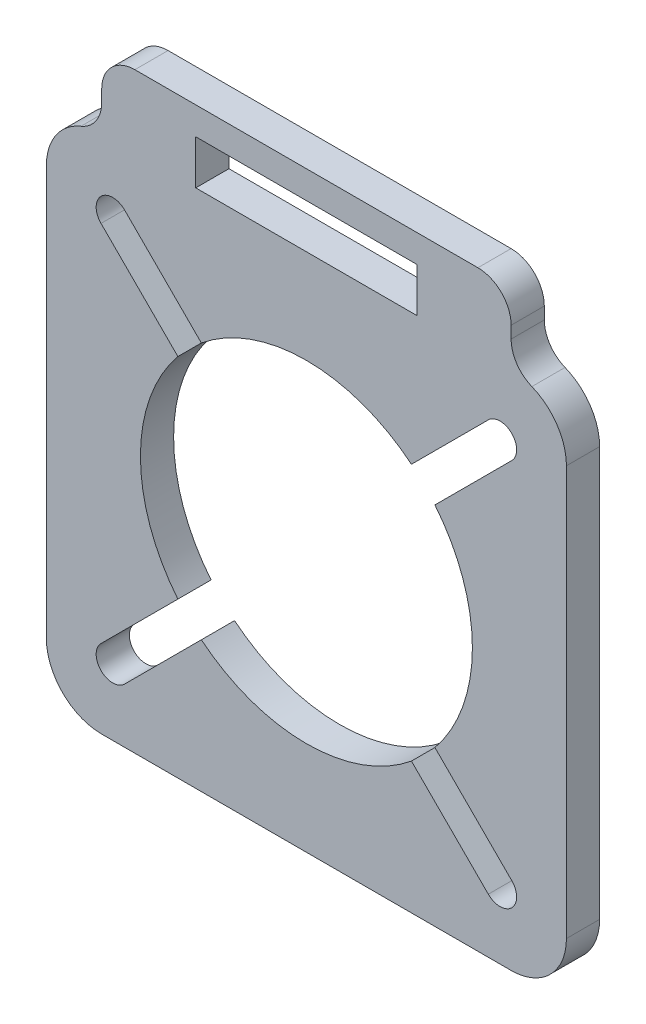
from build123d import *

# Parameters (mm, degrees)
EXTRUDE_1_DEPTH     = 3
SKETCH_2_W          = 37
SKETCH_2_H          = 3
EXTRUDE_2_DEPTH     = 6.5
SKETCH_3_W          = 20
SKETCH_3_H          = 4
CUT_EXTRUDE_1_DEPTH = 5
FILLET_2_R          = 3
EXTRUDE_START       = -3
EXTRUDE_4_DEPTH     = 3


with BuildPart() as part:
    # 草图1 → 凸台-拉伸1 (new body)
    with BuildSketch(Plane.XY):
        with BuildLine():
            Line((18.5, 23.5), (-18.5, 23.5))
            ThreePointArc((-18.5, 23.5), (-22.035533906, 22.035533906), (-23.5, 18.5))
            Line((-23.5, 18.5), (-23.5, -18.5))
            ThreePointArc((-23.5, -18.5), (-22.035533906, -22.035533906), (-18.5, -23.5))
            Line((-18.5, -23.5), (18.5, -23.5))
            ThreePointArc((18.5, -23.5), (22.035533906, -22.035533906), (23.5, -18.5))
            Line((23.5, -18.5), (23.5, 18.5))
            ThreePointArc((23.5, 18.5), (22.035533906, 22.035533906), (18.5, 23.5))
        make_face()
        with BuildLine():
            Line((-12.196084122, 8.732441359), (-19.231821381, 15.768178619))
            ThreePointArc((-19.231821381, 15.768178619), (-19.231821381, 19.231821381), (-15.768178619, 19.231821381))
            Line((-15.768178619, 19.231821381), (-8.732441359, 12.196084122))
            ThreePointArc((-8.732441359, 12.196084122), (0, 15), (8.732441359, 12.196084122))
            Line((8.732441359, 12.196084122), (15.768178619, 19.231821381))
            ThreePointArc((15.768178619, 19.231821381), (19.231821381, 19.231821381), (19.231821381, 15.768178619))
            Line((19.231821381, 15.768178619), (12.196084122, 8.732441359))
            ThreePointArc((12.196084122, 8.732441359), (15, 0), (12.196084122, -8.732441359))
            Line((12.196084122, -8.732441359), (19.231821381, -15.768178619))
            ThreePointArc((19.231821381, -15.768178619), (19.231821381, -19.231821381), (15.768178619, -19.231821381))
            Line((15.768178619, -19.231821381), (8.732441359, -12.196084122))
            ThreePointArc((8.732441359, -12.196084122), (0, -15), (-8.732441359, -12.196084122))
            Line((-8.732441359, -12.196084122), (-15.768178619, -19.231821381))
            ThreePointArc((-15.768178619, -19.231821381), (-19.231821381, -19.231821381), (-19.231821381, -15.768178619))
            Line((-19.231821381, -15.768178619), (-12.196084122, -8.732441359))
            ThreePointArc((-12.196084122, -8.732441359), (-15, 0), (-12.196084122, 8.732441359))
        make_face(mode=Mode.SUBTRACT)
    extrude(amount=EXTRUDE_1_DEPTH)

    # 草图2 → 凸台-拉伸2 (add)
    with BuildSketch(Plane(origin=(0, 23.5, 0), x_dir=(1, 0, 0), z_dir=(0, 1, 0))):
        with Locations((0, -1.5)):
            Rectangle(SKETCH_2_W, SKETCH_2_H)
    extrude(amount=EXTRUDE_2_DEPTH)

    # 草图3 → 切除-拉伸1 (cut)
    with BuildSketch(Plane.XY.offset(3)):
        with Locations((0, 25.5)):
            Rectangle(SKETCH_3_W, SKETCH_3_H)
    extrude(amount=-CUT_EXTRUDE_1_DEPTH, mode=Mode.SUBTRACT)

    # 圆角2
    fillet_2_edges = [part.edges().sort_by_distance(p)[0] for p in [
        (18.5, 23.5, 1.5),
        (18.5, 30, 1.5),
        (-18.5, 30, 1.5),
        (-18.5, 23.5, 1.5),
    ]]
    fillet(fillet_2_edges, radius=FILLET_2_R)

    # 草图5 → 凸台-拉伸4 (add)
    with BuildSketch(Plane.XY.offset(3).offset(EXTRUDE_START)):
        with BuildLine():
            ThreePointArc((-15.768178619, 19.231821381), (-19.231821381, 19.231821381), (-19.231821381, 15.768178619))
            Line((-19.231821381, 15.768178619), (-12.196084122, 8.732441359))
            ThreePointArc((-12.196084122, 8.732441359), (-11.911158294, 9.11725332), (-11.614095631, 9.492775288))
            Line((-11.614095631, 9.492775288), (-18.560660172, 16.439339828))
            ThreePointArc((-18.560660172, 16.439339828), (-18.560660172, 18.560660172), (-16.439339828, 18.560660172))
            Line((-16.439339828, 18.560660172), (-9.492775288, 11.614095631))
            ThreePointArc((-9.492775288, 11.614095631), (-9.11725332, 11.911158294), (-8.732441359, 12.196084122))
            Line((-8.732441359, 12.196084122), (-15.768178619, 19.231821381))
        make_face()
        with BuildLine():
            ThreePointArc((-11.614095631, -9.492775288), (-11.911158294, -9.11725332), (-12.196084122, -8.732441359))
            Line((-12.196084122, -8.732441359), (-19.231821381, -15.768178619))
            ThreePointArc((-19.231821381, -15.768178619), (-19.231821381, -19.231821381), (-15.768178619, -19.231821381))
            Line((-15.768178619, -19.231821381), (-8.732441359, -12.196084122))
            ThreePointArc((-8.732441359, -12.196084122), (-9.11725332, -11.911158294), (-9.492775288, -11.614095631))
            Line((-9.492775288, -11.614095631), (-16.439339828, -18.560660172))
            ThreePointArc((-16.439339828, -18.560660172), (-18.560660172, -18.560660172), (-18.560660172, -16.439339828))
            Line((-18.560660172, -16.439339828), (-11.614095631, -9.492775288))
        make_face()
        with BuildLine():
            Line((15.768178619, 19.231821381), (8.732441359, 12.196084122))
            ThreePointArc((8.732441359, 12.196084122), (9.11725332, 11.911158294), (9.492775288, 11.614095631))
            Line((9.492775288, 11.614095631), (16.439339828, 18.560660172))
            ThreePointArc((16.439339828, 18.560660172), (18.560660172, 18.560660172), (18.560660172, 16.439339828))
            Line((18.560660172, 16.439339828), (11.614095631, 9.492775288))
            ThreePointArc((11.614095631, 9.492775288), (11.911158294, 9.11725332), (12.196084122, 8.732441359))
            Line((12.196084122, 8.732441359), (19.231821381, 15.768178619))
            ThreePointArc((19.231821381, 15.768178619), (19.231821381, 19.231821381), (15.768178619, 19.231821381))
        make_face()
        with BuildLine():
            ThreePointArc((9.492775288, -11.614095631), (9.11725332, -11.911158294), (8.732441359, -12.196084122))
            Line((8.732441359, -12.196084122), (15.768178619, -19.231821381))
            ThreePointArc((15.768178619, -19.231821381), (19.231821381, -19.231821381), (19.231821381, -15.768178619))
            Line((19.231821381, -15.768178619), (12.196084122, -8.732441359))
            ThreePointArc((12.196084122, -8.732441359), (11.911158294, -9.11725332), (11.614095631, -9.492775288))
            Line((11.614095631, -9.492775288), (18.560660172, -16.439339828))
            ThreePointArc((18.560660172, -16.439339828), (18.560660172, -18.560660172), (16.439339828, -18.560660172))
            Line((16.439339828, -18.560660172), (9.492775288, -11.614095631))
        make_face()
    extrude(amount=EXTRUDE_4_DEPTH)


solid = part.part
